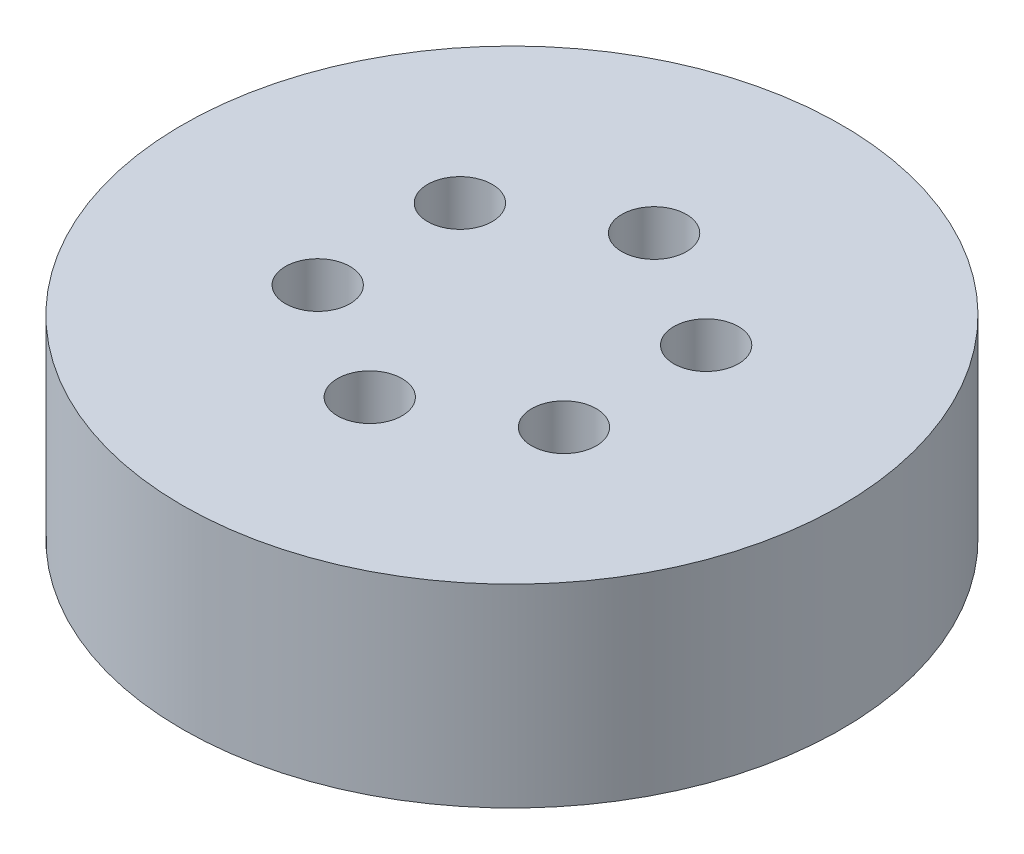
from build123d import *

# Parameters (mm, degrees)
SKETCH_1_R      = 25.5
SKETCH_1_R_2    = 2.5
EXTRUDE_1_DEPTH = 15


with BuildPart() as part:
    # 草图1 → 凸台-拉伸1 (new body)
    with BuildSketch(Plane(origin=(0, 0, 0), x_dir=(1, 0, 0), z_dir=(0, 1, 0))):
        with Locations(Location((0, 0, 0), (0, 0, 270))):
            Circle(SKETCH_1_R)
        with Locations(Location((0, 11, 0), (0, 0, 270))):
            Circle(SKETCH_1_R_2, mode=Mode.SUBTRACT)
        with Locations(Location((9.526279442, 5.5, 0), (0, 0, 270))):
            Circle(SKETCH_1_R_2, mode=Mode.SUBTRACT)
        with Locations(Location((9.526279442, -5.5, 0), (0, 0, 270))):
            Circle(SKETCH_1_R_2, mode=Mode.SUBTRACT)
        with Locations(Location((0, -11, 0), (0, 0, 270))):
            Circle(SKETCH_1_R_2, mode=Mode.SUBTRACT)
        with Locations(Location((-9.526279442, -5.5, 0), (0, 0, 270))):
            Circle(SKETCH_1_R_2, mode=Mode.SUBTRACT)
        with Locations(Location((-9.526279442, 5.5, 0), (0, 0, 270))):
            Circle(SKETCH_1_R_2, mode=Mode.SUBTRACT)
    extrude(amount=EXTRUDE_1_DEPTH)


solid = part.part
